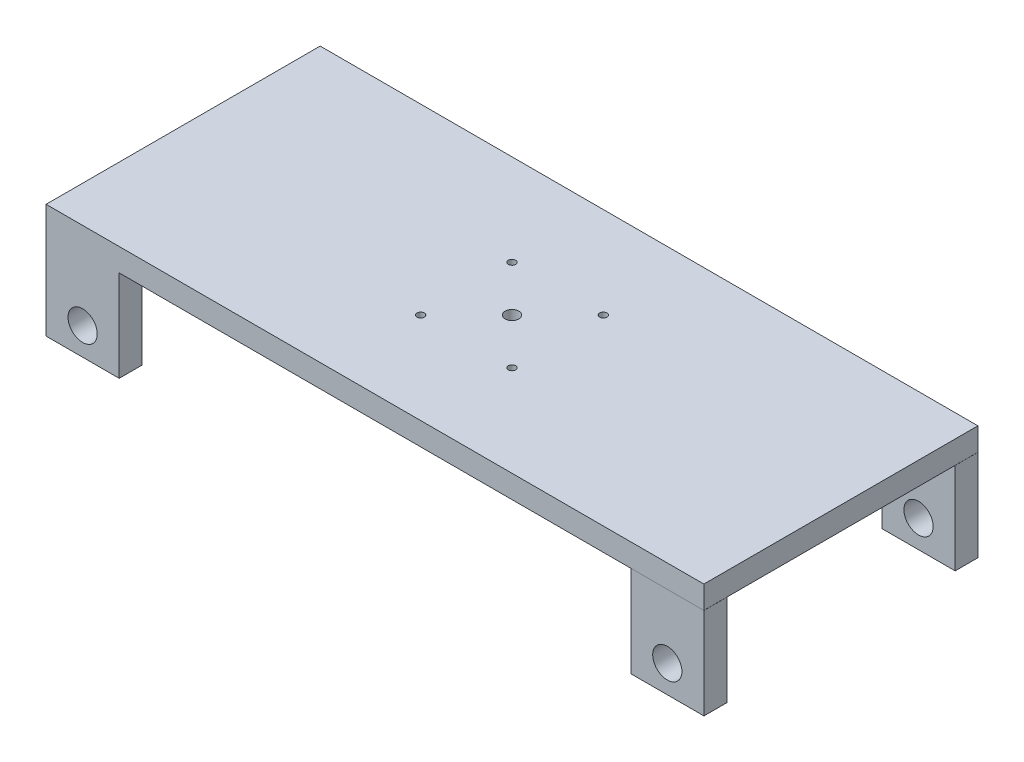
from build123d import *

# Parameters (mm, degrees)
SKETCH1_W                  = 720
SKETCH1_H                  = 300
BOSS_EXTRUDE1_DEPTH        = 25
SKETCH3_W                  = 130
SKETCH3_H                  = 130
BOSS_EXTRUDE3_DEPTH        = 20
CUT_EXTRUDE7_DEPTH         = 391.800460593
CUT_EXTRUDE7_DEPTH_BACK    = 20
SKETCH2_R                  = 7.5
SKETCH4_R                  = 4
CUT_EXTRUDE8_DEPTH         = 393.587569849
BOSS_EXTRUDE4_DEPTH        = 0.1
BOSS_EXTRUDE4_DEPTH_BACK   = 80
SKETCH5_W                  = 25
SKETCH5_H                  = 100
BOSS_EXTRUDE4_2_DEPTH      = 0.1
BOSS_EXTRUDE4_2_DEPTH_BACK = 80
BOSS_EXTRUDE5_DEPTH        = 0.1
BOSS_EXTRUDE5_DEPTH_BACK   = 80
SKETCH6_W                  = 25
SKETCH6_H                  = 100
CUT_EXTRUDE9_DEPTH         = 480.241077121
CUT_EXTRUDE9_DEPTH_BACK    = 480.241077121
SKETCH7_R                  = 16


with BuildPart() as part:
    # Sketch1 → Boss-Extrude1 (new body)
    with BuildSketch(Plane(origin=(0, 0, 0), x_dir=(1, 0, 0), z_dir=(0, 1, 0))):
        Rectangle(SKETCH1_W, SKETCH1_H)
    extrude(amount=BOSS_EXTRUDE1_DEPTH)


with BuildPart() as body_2:
    # Sketch3 → Boss-Extrude3 (new body)
    with BuildSketch(Plane(origin=(0, 0, 0), x_dir=(1, 0, 0), z_dir=(0, 1, 0))):
        Rectangle(SKETCH3_W, SKETCH3_H)
    extrude(amount=-BOSS_EXTRUDE3_DEPTH)


with BuildPart() as cut_extrude7_tool:
    # Sketch2 → Cut-Extrude7 (new, two sides: drawn at the far end of the back side and taken through both)
    with BuildSketch(Plane(origin=(0, 0, 0), x_dir=(1, 0, 0), z_dir=(0, 1, 0)).offset(-CUT_EXTRUDE7_DEPTH_BACK)):
        with Locations(Location((0, 0, 0), (0, 0, 90))):
            Circle(SKETCH2_R)
    extrude(amount=CUT_EXTRUDE7_DEPTH + CUT_EXTRUDE7_DEPTH_BACK)


with BuildPart() as part_1:
    add(part.part)

    # Cut-Extrude7: cut by cut_extrude7_tool
    add(cut_extrude7_tool.part, mode=Mode.SUBTRACT)


with BuildPart() as body_2_1:
    add(body_2.part)

    # Cut-Extrude7: cut by cut_extrude7_tool
    add(cut_extrude7_tool.part, mode=Mode.SUBTRACT)


with BuildPart() as cut_extrude8_tool:
    # Sketch4 → Cut-Extrude8 (new, through all)
    with BuildSketch(Plane(origin=(0, -20, 0), x_dir=(-1, 0, 0), z_dir=(0, -1, 0))):
        with Locations(Location((50, 50, 0), (0, 0, 90))):
            Circle(SKETCH4_R)
        with Locations(Location((50, -50, 0), (0, 0, 90))):
            Circle(SKETCH4_R)
        with Locations(Location((-50, -50, 0), (0, 0, 90))):
            Circle(SKETCH4_R)
        with Locations(Location((-50, 50, 0), (0, 0, 90))):
            Circle(SKETCH4_R)
    extrude(amount=-CUT_EXTRUDE8_DEPTH)


with BuildPart() as part_2:
    add(part_1.part)

    # Cut-Extrude8: cut by cut_extrude8_tool
    add(cut_extrude8_tool.part, mode=Mode.SUBTRACT)

    # Sketch6 → Boss-Extrude5 (add, two sides: drawn at the far end of the back side and taken through both)
    with BuildSketch(Plane.ZY.offset(360).offset(-BOSS_EXTRUDE5_DEPTH_BACK)):
        with Locations((-137.5, -50)):
            Rectangle(SKETCH6_W, SKETCH6_H)
        with Locations((137.5, -50)):
            Rectangle(SKETCH6_W, SKETCH6_H)
    extrude(amount=BOSS_EXTRUDE5_DEPTH + BOSS_EXTRUDE5_DEPTH_BACK)


with BuildPart() as body_2_2:
    add(body_2_1.part)

    # Cut-Extrude8: cut by cut_extrude8_tool
    add(cut_extrude8_tool.part, mode=Mode.SUBTRACT)


with BuildPart() as body_3:
    # Sketch5 → Boss-Extrude4 (new, two sides: drawn at the far end of the back side and taken through both)
    with BuildSketch(Plane(origin=(360, 0, 0), x_dir=(0, 0, -1), z_dir=(1, 0, 0)).offset(-BOSS_EXTRUDE4_DEPTH_BACK)):
        with Locations((-137.5, -50)):
            Rectangle(SKETCH5_W, SKETCH5_H)
    extrude(amount=BOSS_EXTRUDE4_DEPTH + BOSS_EXTRUDE4_DEPTH_BACK)


with BuildPart() as body_4:
    # Sketch5 → Boss-Extrude4 2 (new, two sides: drawn at the far end of the back side and taken through both)
    with BuildSketch(Plane(origin=(360, 0, 0), x_dir=(0, 0, -1), z_dir=(1, 0, 0)).offset(-BOSS_EXTRUDE4_2_DEPTH_BACK)):
        with Locations((137.5, -50)):
            Rectangle(SKETCH5_W, SKETCH5_H)
    extrude(amount=BOSS_EXTRUDE4_2_DEPTH + BOSS_EXTRUDE4_2_DEPTH_BACK)


with BuildPart() as cut_extrude9_tool:
    # Sketch7 → Cut-Extrude9 (new, two sides: drawn at the far end of the back side and taken through both)
    with BuildSketch(Plane.XY.offset(150).offset(-CUT_EXTRUDE9_DEPTH_BACK)):
        with Locations((320, -70)):
            Circle(SKETCH7_R)
        with Locations(Location((-320, -70, 0), (0, 0, 90))):
            Circle(SKETCH7_R)
    extrude(amount=CUT_EXTRUDE9_DEPTH + CUT_EXTRUDE9_DEPTH_BACK)


with BuildPart() as part_3:
    add(part_2.part)

    # Cut-Extrude9: cut by cut_extrude9_tool
    add(cut_extrude9_tool.part, mode=Mode.SUBTRACT)


with BuildPart() as body_3_1:
    add(body_3.part)

    # Cut-Extrude9: cut by cut_extrude9_tool
    add(cut_extrude9_tool.part, mode=Mode.SUBTRACT)


with BuildPart() as body_4_1:
    add(body_4.part)

    # Cut-Extrude9: cut by cut_extrude9_tool
    add(cut_extrude9_tool.part, mode=Mode.SUBTRACT)


solid = Compound([body_2_2.part, part_3.part, body_3_1.part, body_4_1.part])
